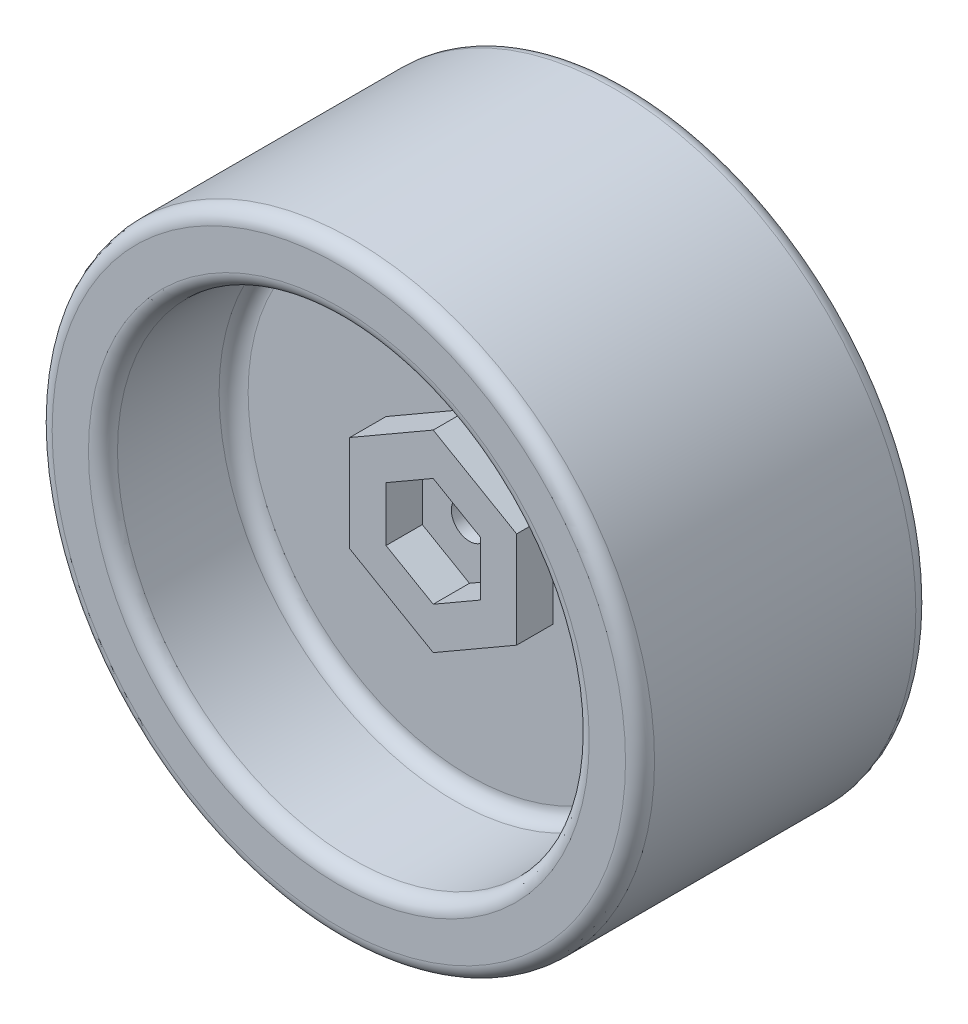
from build123d import *

# Parameters (mm, degrees)
SKETCH1_R           = 41.5
BOSS_EXTRUDE1_DEPTH = 40
SKETCH2_R           = 2.5
CUT_EXTRUDE1_DEPTH  = 72.024643611
SKETCH4_R           = 32.5
CUT_EXTRUDE2_DEPTH  = 18
CUT_EXTRUDE3_START  = -18
SKETCH5_R           = 32.5
CUT_EXTRUDE3_DEPTH  = 18
BOSS_EXTRUDE2_START = 5
SKETCH6_R           = 2.5
BOSS_EXTRUDE2_DEPTH = 5
BOSS_EXTRUDE3_START = 17
SKETCH7_R           = 5.75
SKETCH7_R_2         = 2.5
BOSS_EXTRUDE3_DEPTH = 17
FILLET3_R           = 2
BOSS_EXTRUDE4_DEPTH = 5
CUT_EXTRUDE4_DEPTH  = 22


with BuildPart() as part:
    # Sketch1 → Boss-Extrude1 (new body)
    with BuildSketch(Plane.XY):
        Circle(SKETCH1_R)
    extrude(amount=BOSS_EXTRUDE1_DEPTH)

    # Sketch2 → Cut-Extrude1 (cut, through all)
    with BuildSketch(Plane.XY.offset(40)):
        Circle(SKETCH2_R)
    extrude(amount=-CUT_EXTRUDE1_DEPTH, mode=Mode.SUBTRACT)

    # Sketch4 → Cut-Extrude2 (cut)
    with BuildSketch(Plane(origin=(0, 0, 0), x_dir=(-1, 0, 0), z_dir=(0, 0, -1))):
        Circle(SKETCH4_R)
    extrude(amount=-CUT_EXTRUDE2_DEPTH, mode=Mode.SUBTRACT)

    # Sketch5 → Cut-Extrude3 (cut)
    with BuildSketch(Plane.XY.offset(40).offset(CUT_EXTRUDE3_START)):
        with Locations(Location((0, 0, 0), (0, 0, 180))):
            Circle(SKETCH5_R)
    extrude(amount=CUT_EXTRUDE3_DEPTH, mode=Mode.SUBTRACT)

    # Sketch6 → Boss-Extrude2 (add)
    with BuildSketch(Plane.XY.offset(22).offset(BOSS_EXTRUDE2_START)):
        Polygon((0, 6.92820323), (-6, 3.464101615), (-6, -3.464101615), (0, -6.92820323), (6, -3.464101615), (6, 3.464101615), align=None)
        Circle(SKETCH6_R, mode=Mode.SUBTRACT)
    extrude(amount=-BOSS_EXTRUDE2_DEPTH)

    # Sketch7 → Boss-Extrude3 (add)
    with BuildSketch(Plane.XY.offset(27).offset(BOSS_EXTRUDE3_START)):
        Circle(SKETCH7_R)
        Circle(SKETCH7_R_2, mode=Mode.SUBTRACT)
    extrude(amount=-BOSS_EXTRUDE3_DEPTH)

    # Fillet3
    fillet3_edges = [part.edges().sort_by_distance(p)[0] for p in [
        (32.5, 0, 0),
        (32.5, 0, 18),
        (32.5, 0, 40),
        (32.5, 0, 22),
        (-41.5, 0, 0),
        (-41.5, 0, 40),
    ]]
    fillet(fillet3_edges, radius=FILLET3_R)

    # Sketch8 → Boss-Extrude4 (add)
    with BuildSketch(Plane.XY.offset(22)):
        Polygon((11.5, 6.639528096), (0, 13.279056191), (-11.5, 6.639528096), (-11.5, -6.639528096), (0, -13.279056191), (11.5, -6.639528096), align=None)
        Polygon((6.5, 3.75277675), (0, 7.505553499), (-6.5, 3.75277675), (-6.5, -3.75277675), (0, -7.505553499), (6.5, -3.75277675), align=None, mode=Mode.SUBTRACT)
    extrude(amount=BOSS_EXTRUDE4_DEPTH)

    # Sketch9 → Cut-Extrude4 (cut)
    with BuildSketch(Plane.XY.offset(44)):
        Polygon((0, 7.247698374), (-6.276690911, 3.623849187), (-6.276690911, -3.623849187), (0, -7.247698374), (6.276690911, -3.623849187), (6.276690911, 3.623849187), align=None)
    extrude(amount=-CUT_EXTRUDE4_DEPTH, mode=Mode.SUBTRACT)


solid = part.part
